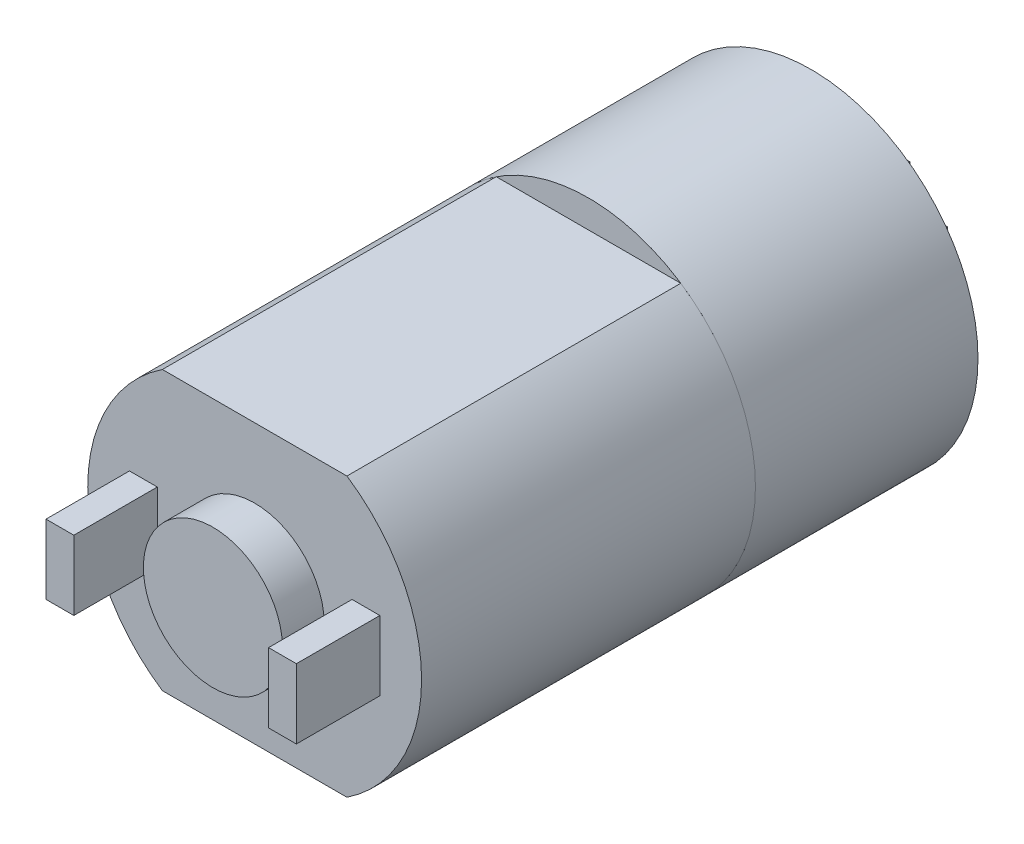
from build123d import *

# Parameters (mm, degrees)
CROQUIS1_R                = 6
SALIENTE_EXTRUIR1_DEPTH   = 8
SALIENTE_EXTRUIR2_DEPTH   = 12
SALIENTE_EXTRUIR3_DEPTH   = 2.7
CROQUIS4_R                = 0.752318365
SALIENTE_EXTRUIR4_DEPTH   = 0.8
CROQUIS5_R                = 2.5
SALIENTE_EXTRUIR5_DEPTH   = 1.5
CROQUIS6_W                = 1
CROQUIS6_H                = 2.5
SALIENTE_EXTRUIR6_DEPTH   = 3
SALIENTE_EXTRUIR6_2_DEPTH = 3


with BuildPart() as part:
    # Croquis1 → Saliente-Extruir1 (new body)
    with BuildSketch(Plane.XY):
        Circle(CROQUIS1_R)
    extrude(amount=SALIENTE_EXTRUIR1_DEPTH)

    # Croquis3 → Saliente-Extruir3 (add)
    with BuildSketch(Plane(origin=(0, 0, 0), x_dir=(-1, 0, 0), z_dir=(0, 0, -1))):
        Polygon((-2.2, 0.85), (-0.85, 0.85), (-0.85, 2.2), (0.85, 2.2), (0.85, 0.85), (2.2, 0.85), (2.2, -0.85), (0.85, -0.85), (0.85, -2.2), (-0.85, -2.2), (-0.85, -0.85), (-2.2, -0.85), align=None)
    extrude(amount=SALIENTE_EXTRUIR3_DEPTH)

    # Croquis4 → Saliente-Extruir4 (add)
    with BuildSketch(Plane(origin=(0, 0, -2.7), x_dir=(-1, 0, 0), z_dir=(0, 0, -1))):
        Circle(CROQUIS4_R)
    extrude(amount=SALIENTE_EXTRUIR4_DEPTH)


with BuildPart() as body_2:
    # Croquis2 → Saliente-Extruir2 (new body)
    with BuildSketch(Plane.XY.offset(8)):
        with BuildLine():
            Line((3.31662479, 5), (-3.31662479, 5))
            ThreePointArc((-3.31662479, 5), (-6, 0), (-3.31662479, -5))
            Line((-3.31662479, -5), (3.31662479, -5))
            ThreePointArc((3.31662479, -5), (6, 0), (3.31662479, 5))
        make_face()
    extrude(amount=SALIENTE_EXTRUIR2_DEPTH)

    # Croquis5 → Saliente-Extruir5 (add)
    with BuildSketch(Plane.XY.offset(20)):
        Circle(CROQUIS5_R)
    extrude(amount=SALIENTE_EXTRUIR5_DEPTH)


with BuildPart() as body_3:
    # Croquis6 → Saliente-Extruir6 (new body)
    with BuildSketch(Plane.XY.offset(20)):
        with Locations((-4, 0)):
            Rectangle(CROQUIS6_W, CROQUIS6_H)
    extrude(amount=SALIENTE_EXTRUIR6_DEPTH)


with BuildPart() as body_4:
    # Croquis6 → Saliente-Extruir6 2 (new body)
    with BuildSketch(Plane.XY.offset(20)):
        with Locations((4, 0)):
            Rectangle(CROQUIS6_W, CROQUIS6_H)
    extrude(amount=SALIENTE_EXTRUIR6_2_DEPTH)


solid = Compound([part.part, body_2.part, body_3.part, body_4.part])
